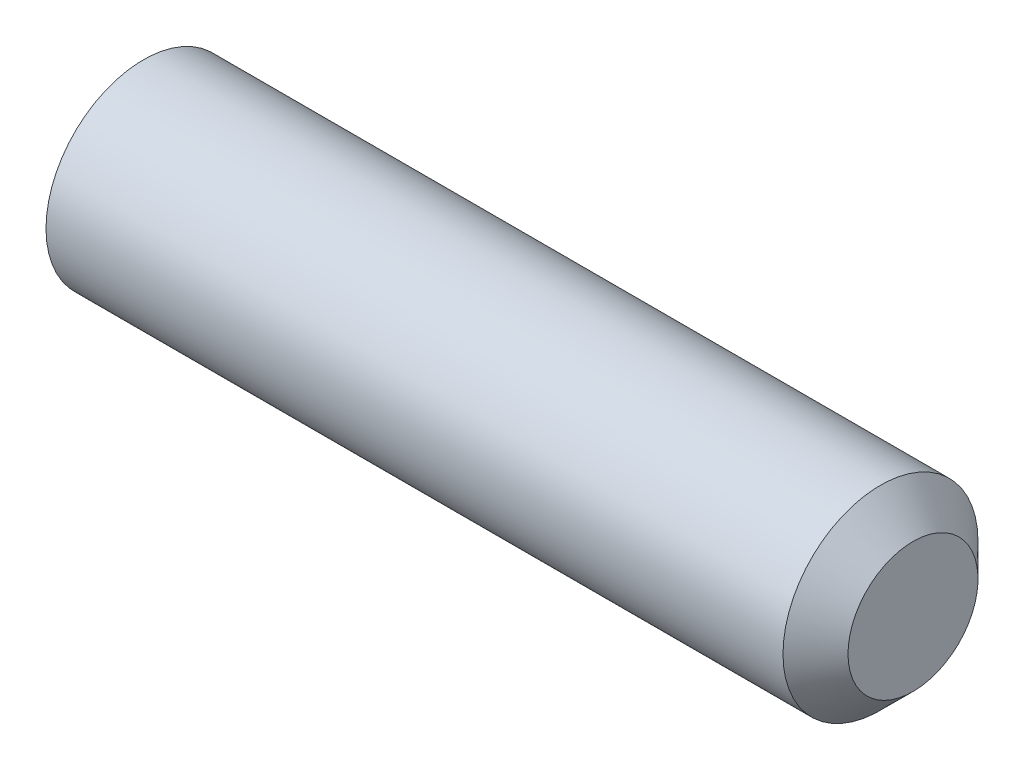
from build123d import *

# Parameters (mm, degrees)
HEX_2_DEPTH = 2.1


with BuildPart() as part:
    # BodySke → BaseBody (revolve)
    with BuildSketch(Plane.XY, mode=Mode.PRIVATE) as basebody_sk:
        Polygon((0, 0), (0, 1.2195), (0.161946751, 1.5), (11.5, 1.5), (12, 1), (12, 0), align=None)
    revolve(basebody_sk.sketch.rotate(Axis((-12.7, 0, 0), (1, 0, 0)), 90), axis=Axis((-12.7, 0, 0), (1, 0, 0)))

    # Sketch2 → Hex 2 (cut)
    with BuildSketch(Plane.ZY):
        Polygon((0.433012702, 0.75), (-0.433012702, 0.75), (-0.866025404, 0), (-0.433012702, -0.75), (0.433012702, -0.75), (0.866025404, 0), align=None)
    extrude(amount=-HEX_2_DEPTH, mode=Mode.SUBTRACT)


solid = part.part
